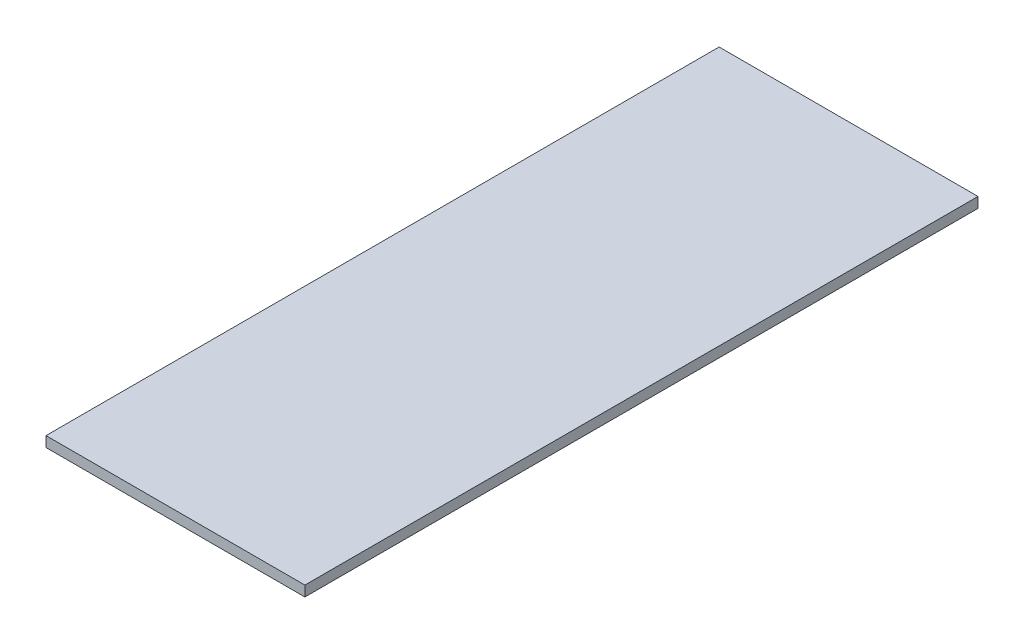
from build123d import *

# Parameters (mm, degrees)
SKETCH1_W           = 127
SKETCH1_H           = 330.2
BOSS_EXTRUDE1_DEPTH = 5.08


with BuildPart() as part:
    # Sketch1 → Boss-Extrude1 (new body)
    with BuildSketch(Plane(origin=(0, 0, 0), x_dir=(1, 0, 0), z_dir=(0, 1, 0))):
        with Locations((3.381011728, 79.155940419)):
            Rectangle(SKETCH1_W, SKETCH1_H)
    extrude(amount=BOSS_EXTRUDE1_DEPTH)


solid = part.part
